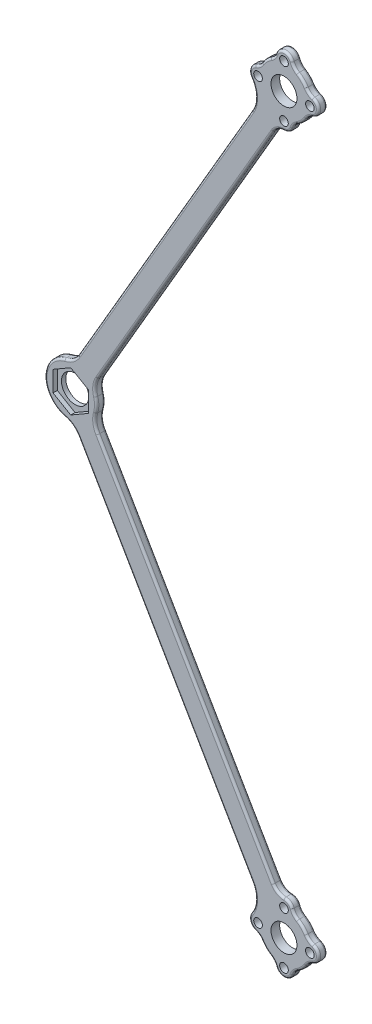
from build123d import *

# Parameters (mm, degrees)
SKETCH_1_R          = 3.15
SKETCH_1_R_2        = 1
SKETCH_1_R_3        = 3
EXTRUDE_1_DEPTH     = 2
FILLET_1_R          = 0.5
CUT_EXTRUDE_1_DEPTH = 1


with BuildPart() as part:
    # 草图1 → 凸台-拉伸1 (new body)
    with BuildSketch(Plane.XY):
        with BuildLine():
            Line((-92.254208051, 77.297953638), (-132.450228807, 8.181456708))
            ThreePointArc((-132.450228807, 8.181456708), (-133.786405309, 6.684683099), (-135.603416603, 5.833701997))
            ThreePointArc((-135.603416603, 5.833701997), (-140.200590524, 0), (-135.603416603, -5.833701997))
            ThreePointArc((-135.603416603, -5.833701997), (-133.786405309, -6.684683099), (-132.450228807, -8.181456708))
            Line((-132.450228807, -8.181456708), (-92.254208051, -77.297953638))
            ThreePointArc((-92.254208051, -77.297953638), (-91.445245388, -80.543722179), (-92.499825178, -83.718197802))
            ThreePointArc((-92.499825178, -83.718197802), (-92.755109718, -85.470284407), (-91.519480409, -86.738431826))
            ThreePointArc((-91.519480409, -86.738431826), (-90.633862326, -87.233525617), (-89.963924853, -87.995510548))
            ThreePointArc((-89.963924853, -87.995510548), (-89.09545443, -89.09545443), (-87.995510548, -89.963924853))
            ThreePointArc((-87.995510548, -89.963924853), (-87.233525617, -90.633862326), (-86.738431826, -91.519480409))
            ThreePointArc((-86.738431826, -91.519480409), (-84.852813742, -92.852813742), (-82.967195659, -91.519480409))
            ThreePointArc((-82.967195659, -91.519480409), (-82.472101868, -90.633862326), (-81.710116937, -89.963924853))
            ThreePointArc((-81.710116937, -89.963924853), (-80.610173055, -89.09545443), (-79.741702631, -87.995510548))
            ThreePointArc((-79.741702631, -87.995510548), (-79.071765159, -87.233525617), (-78.186147076, -86.738431826))
            ThreePointArc((-78.186147076, -86.738431826), (-76.852813742, -84.852813742), (-78.186147076, -82.967195659))
            ThreePointArc((-78.186147076, -82.967195659), (-79.071765159, -82.472101868), (-79.741702631, -81.710116937))
            ThreePointArc((-79.741702631, -81.710116937), (-80.610173055, -80.610173055), (-81.710116937, -79.741702631))
            ThreePointArc((-81.710116937, -79.741702631), (-82.472101868, -79.071765159), (-82.967195659, -78.186147076))
            ThreePointArc((-82.967195659, -78.186147076), (-83.684875981, -77.229261654), (-84.820296909, -76.853078096))
            ThreePointArc((-84.820296909, -76.853078096), (-86.288507757, -76.441669592), (-87.364847376, -75.361672799))
            Line((-87.364847376, -75.361672799), (-127.955130898, -5.567246543))
            ThreePointArc((-127.955130898, -5.567246543), (-128.595310838, -3.665702822), (-128.436407349, -1.665590685))
            ThreePointArc((-128.436407349, -1.665590685), (-128.200590524, 0), (-128.436407349, 1.665590685))
            ThreePointArc((-128.436407349, 1.665590685), (-128.595310838, 3.665702822), (-127.955130898, 5.567246543))
            Line((-127.955130898, 5.567246543), (-87.364847376, 75.361672799))
            ThreePointArc((-87.364847376, 75.361672799), (-86.288507757, 76.441669592), (-84.820296909, 76.853078096))
            ThreePointArc((-84.820296909, 76.853078096), (-83.684875981, 77.229261654), (-82.967195659, 78.186147076))
            ThreePointArc((-82.967195659, 78.186147076), (-82.472101868, 79.071765159), (-81.710116937, 79.741702631))
            ThreePointArc((-81.710116937, 79.741702631), (-80.610173055, 80.610173055), (-79.741702631, 81.710116937))
            ThreePointArc((-79.741702631, 81.710116937), (-79.071765159, 82.472101868), (-78.186147076, 82.967195659))
            ThreePointArc((-78.186147076, 82.967195659), (-76.852813742, 84.852813742), (-78.186147076, 86.738431826))
            ThreePointArc((-78.186147076, 86.738431826), (-79.071765159, 87.233525617), (-79.741702631, 87.995510548))
            ThreePointArc((-79.741702631, 87.995510548), (-80.610173055, 89.09545443), (-81.710116937, 89.963924853))
            ThreePointArc((-81.710116937, 89.963924853), (-82.472101868, 90.633862326), (-82.967195659, 91.519480409))
            ThreePointArc((-82.967195659, 91.519480409), (-84.852813742, 92.852813742), (-86.738431826, 91.519480409))
            ThreePointArc((-86.738431826, 91.519480409), (-87.233525617, 90.633862326), (-87.995510548, 89.963924853))
            ThreePointArc((-87.995510548, 89.963924853), (-89.09545443, 89.09545443), (-89.963924853, 87.995510548))
            ThreePointArc((-89.963924853, 87.995510548), (-90.633862326, 87.233525617), (-91.519480409, 86.738431826))
            ThreePointArc((-91.519480409, 86.738431826), (-92.755109718, 85.470284407), (-92.499825178, 83.718197802))
            ThreePointArc((-92.499825178, 83.718197802), (-91.445245388, 80.543722179), (-92.254208051, 77.297953638))
        make_face()
        with Locations((-134.200590524, 0)):
            Circle(SKETCH_1_R, mode=Mode.SUBTRACT)
        with Locations((-84.852813742, -90.852813742)):
            Circle(SKETCH_1_R_2, mode=Mode.SUBTRACT)
        with Locations((-90.852813742, -84.852813742)):
            Circle(SKETCH_1_R_2, mode=Mode.SUBTRACT)
        with Locations((-84.852813742, -78.852813742)):
            Circle(SKETCH_1_R_2, mode=Mode.SUBTRACT)
        with Locations((-78.852813742, -84.852813742)):
            Circle(SKETCH_1_R_2, mode=Mode.SUBTRACT)
        with Locations((-84.852813742, 78.852813742)):
            Circle(SKETCH_1_R_2, mode=Mode.SUBTRACT)
        with Locations((-84.852813742, 90.852813742)):
            Circle(SKETCH_1_R_2, mode=Mode.SUBTRACT)
        with Locations((-78.852813742, 84.852813742)):
            Circle(SKETCH_1_R_2, mode=Mode.SUBTRACT)
        with Locations((-90.852813742, 84.852813742)):
            Circle(SKETCH_1_R_2, mode=Mode.SUBTRACT)
        with Locations((-84.852813742, 84.852813742)):
            Circle(SKETCH_1_R_3, mode=Mode.SUBTRACT)
        with Locations((-84.852813742, -84.852813742)):
            Circle(SKETCH_1_R_3, mode=Mode.SUBTRACT)
    extrude(amount=EXTRUDE_1_DEPTH)

    # 圆角1
    fillet_1_edges = [part.edges().sort_by_distance(p)[0] for p in [
        (-128.595310838, -3.665702822, 2),
        (-128.200590524, 0, 2),
        (-128.595310838, 3.665702822, 2),
        (-107.659989137, 40.464459671, 2),
        (-86.288507757, 76.441669592, 2),
        (-83.684875981, 77.229261654, 2),
        (-82.472101868, 79.071765159, 2),
        (-80.610173055, 80.610173055, 2),
        (-91.445245388, 80.543722179, 2),
        (-79.071765159, 82.472101868, 2),
        (-76.852813742, 84.852813742, 2),
        (-79.071765159, 87.233525617, 2),
        (-80.610173055, 89.09545443, 2),
        (-82.472101868, 90.633862326, 2),
        (-84.852813742, 92.852813742, 2),
        (-87.233525617, 90.633862326, 2),
        (-89.09545443, 89.09545443, 2),
        (-112.352218429, 42.739705173, 2),
        (-133.786405309, 6.684683099, 2),
        (-140.200590524, 0, 2),
        (-133.786405309, -6.684683099, 2),
        (-112.352218429, -42.739705173, 2),
        (-91.445245388, -80.543722179, 2),
        (-89.09545443, 89.09545443, 0),
        (-87.233525617, 90.633862326, 0),
        (-84.852813742, 92.852813742, 0),
        (-82.472101868, 90.633862326, 0),
        (-80.610173055, 89.09545443, 0),
        (-79.071765159, 87.233525617, 0),
        (-76.852813742, 84.852813742, 0),
        (-79.071765159, 82.472101868, 0),
        (-80.610173055, 80.610173055, 0),
        (-92.755109718, -85.470284407, 2),
        (-82.472101868, 79.071765159, 0),
        (-83.684875981, 77.229261654, 0),
        (-86.288507757, 76.441669592, 0),
        (-107.659989137, 40.464459671, 0),
        (-128.595310838, 3.665702822, 0),
        (-128.200590524, 0, 0),
        (-128.595310838, -3.665702822, 0),
        (-107.659989137, -40.464459671, 0),
        (-86.288507757, -76.441669592, 0),
        (-83.684875981, -77.229261654, 0),
        (-90.633862326, -87.233525617, 2),
        (-82.472101868, -79.071765159, 0),
        (-80.610173055, -80.610173055, 0),
        (-79.071765159, -82.472101868, 0),
        (-76.852813742, -84.852813742, 0),
        (-79.071765159, -87.233525617, 0),
        (-80.610173055, -89.09545443, 0),
        (-82.472101868, -90.633862326, 0),
        (-84.852813742, -92.852813742, 0),
        (-87.233525617, -90.633862326, 0),
        (-89.09545443, -89.09545443, 0),
        (-89.09545443, -89.09545443, 2),
        (-90.633862326, -87.233525617, 0),
        (-92.755109718, -85.470284407, 0),
        (-91.445245388, -80.543722179, 0),
        (-90.633862326, 87.233525617, 2),
        (-112.352218429, -42.739705173, 0),
        (-133.786405309, -6.684683099, 0),
        (-140.200590524, 0, 0),
        (-133.786405309, 6.684683099, 0),
        (-112.352218429, 42.739705173, 0),
        (-91.445245388, 80.543722179, 0),
        (-92.755109718, 85.470284407, 0),
        (-87.233525617, -90.633862326, 2),
        (-90.633862326, 87.233525617, 0),
        (-84.852813742, -92.852813742, 2),
        (-82.472101868, -90.633862326, 2),
        (-80.610173055, -89.09545443, 2),
        (-79.071765159, -87.233525617, 2),
        (-76.852813742, -84.852813742, 2),
        (-79.071765159, -82.472101868, 2),
        (-80.610173055, -80.610173055, 2),
        (-82.472101868, -79.071765159, 2),
        (-83.684875981, -77.229261654, 2),
        (-92.755109718, 85.470284407, 2),
        (-86.288507757, -76.441669592, 2),
        (-107.659989137, -40.464459671, 2),
    ]]
    fillet(fillet_1_edges, radius=FILLET_1_R)

    # 草图2 → 切除-拉伸1 (cut)
    with BuildSketch(Plane.XY.offset(2)):
        Polygon((-134.200590524, 4.734272207), (-138.300590524, 2.367136104), (-138.300590524, -2.367136104), (-134.200590524, -4.734272207), (-130.100590524, -2.367136104), (-130.100590524, 2.367136104), align=None)
    extrude(amount=-CUT_EXTRUDE_1_DEPTH, mode=Mode.SUBTRACT)


solid = part.part
